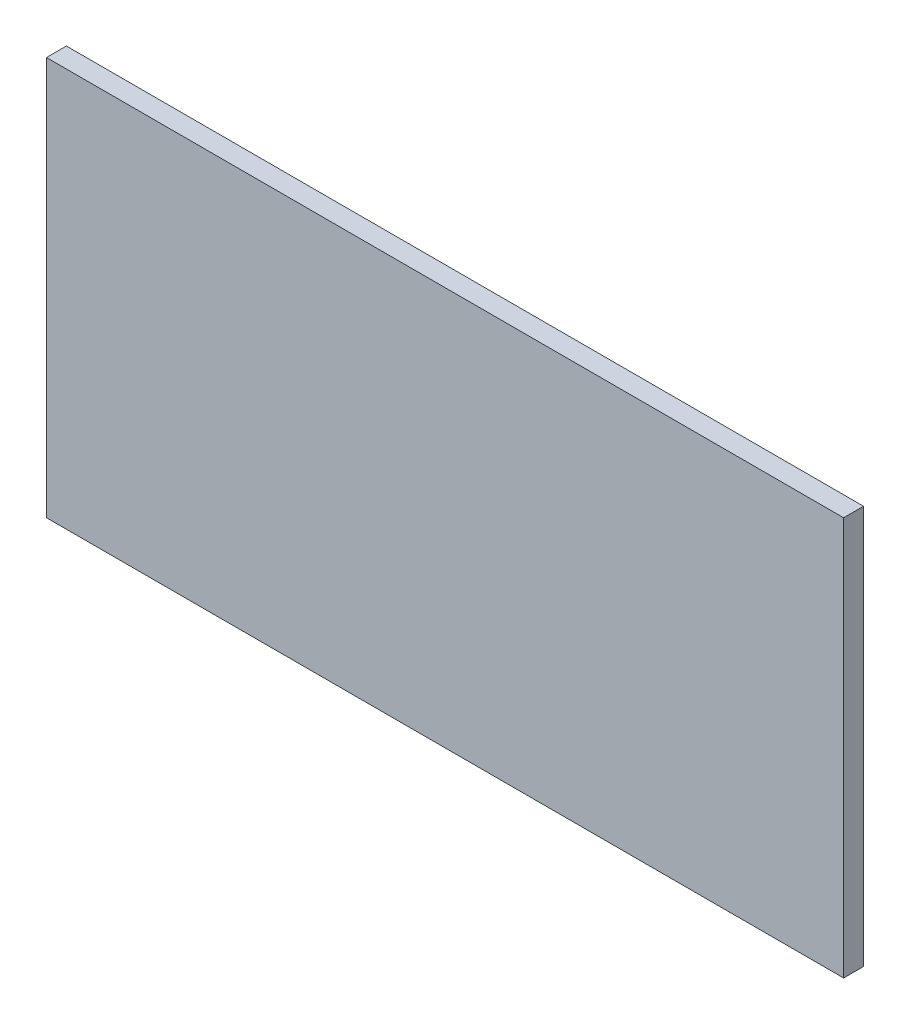
from build123d import *

# Parameters (mm, degrees)
ESQUISSE1_W        = 127
ESQUISSE1_H        = 63.5
BOSS_EXTRU_1_DEPTH = 3.175


with BuildPart() as part:
    # Esquisse1 → Boss.-Extru.1 (new body)
    with BuildSketch(Plane.XY):
        Rectangle(ESQUISSE1_W, ESQUISSE1_H)
    extrude(amount=BOSS_EXTRU_1_DEPTH)


solid = part.part
